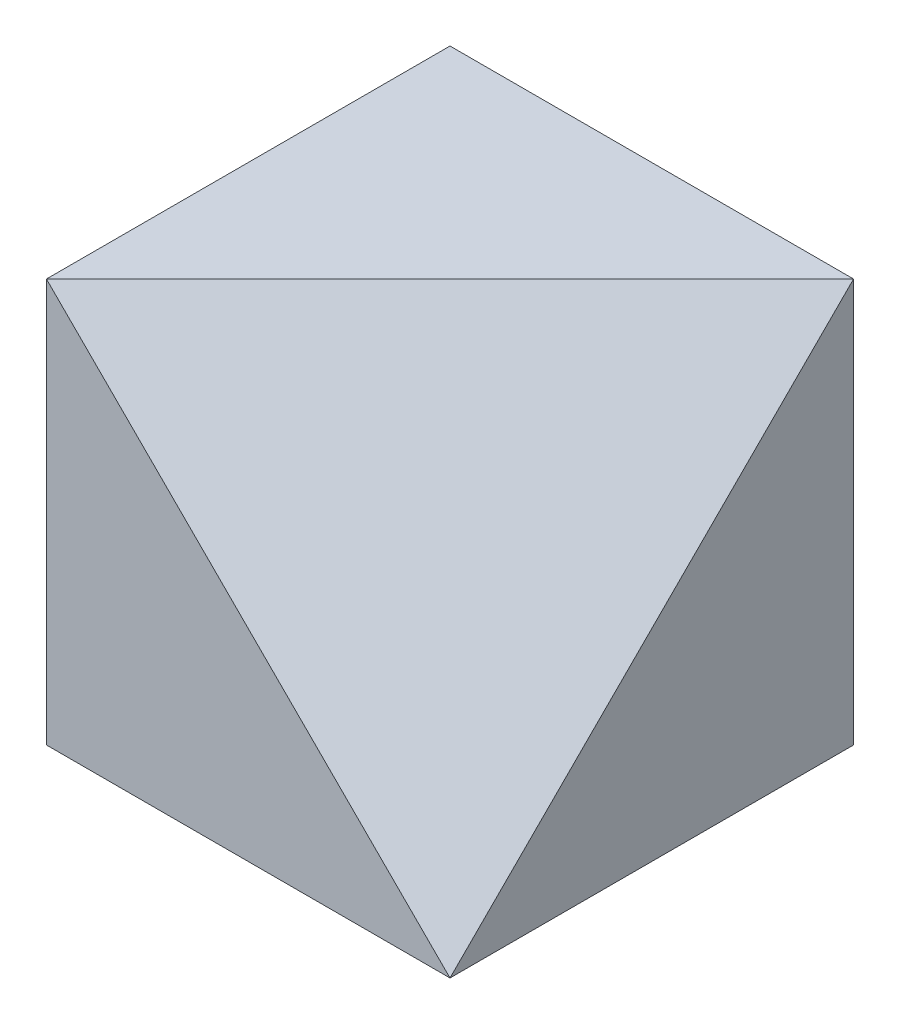
from build123d import *

# Parameters (mm, degrees)
SKETCH1_W           = 80
SKETCH1_H           = 80
BOSS_EXTRUDE1_DEPTH = 80
CUT_EXTRUDE1_DEPTH  = 80
CUT_EXTRUDE2_DEPTH  = 80


with BuildPart() as part:
    # Sketch1 → Boss-Extrude1 (new body)
    with BuildSketch(Plane(origin=(0, 0, 0), x_dir=(1, 0, 0), z_dir=(0, 1, 0))):
        Rectangle(SKETCH1_W, SKETCH1_H)
    extrude(amount=BOSS_EXTRUDE1_DEPTH)

    # Sketch5 → Cut-Extrude1 (cut)
    with BuildSketch(Plane(origin=(26.666666667, 26.666666667, 26.666666667), x_dir=(0.8164965809277261, -0.40824829046386296, -0.4082482904638629), z_dir=(0.5773502691896256, 0.5773502691896263, 0.5773502691896254))):
        Polygon((-81.649658093, 28.284271247), (16.329931619, -28.284271247), (16.329931619, 84.852813742), align=None)
    extrude(amount=CUT_EXTRUDE1_DEPTH, mode=Mode.SUBTRACT)

    # Sketch6 → Cut-Extrude2 (cut)
    with BuildSketch(Plane(origin=(0, 0, 0), x_dir=(0.8164965809277261, -0.40824829046386296, -0.4082482904638629), z_dir=(0.5773502691896256, 0.5773502691896263, 0.5773502691896254))):
        Polygon((-48.989794856, -28.284271247), (48.989794856, 28.284271247), (-48.989794856, 84.852813742), align=None)
    extrude(amount=-CUT_EXTRUDE2_DEPTH, mode=Mode.SUBTRACT)


solid = part.part
